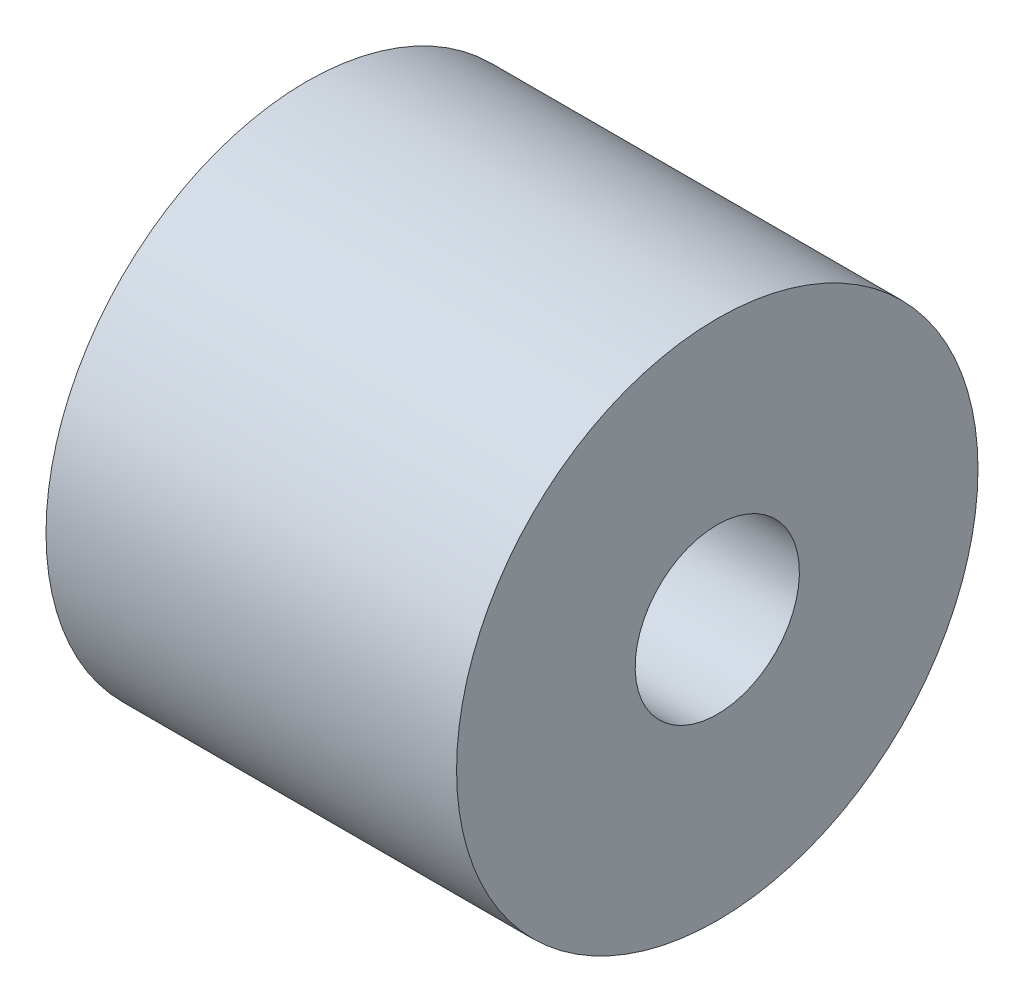
from build123d import *

# Parameters (mm, degrees)
ESQUISSE1_R        = 6.35
ESQUISSE1_R_2      = 2
BOSS_EXTRU_1_DEPTH = 10


with BuildPart() as part:
    # Esquisse1 → Boss.-Extru.1 (new body)
    with BuildSketch(Plane(origin=(-130.403171357, 0, 0), x_dir=(0, 0, -1), z_dir=(1, 0, 0))):
        with Locations(Location((-120.908236412, 39.009623756, 0), (0, 0, 90))):
            Circle(ESQUISSE1_R)
        with Locations(Location((-120.908236412, 39.009623756, 0), (0, 0, 90))):
            Circle(ESQUISSE1_R_2, mode=Mode.SUBTRACT)
    extrude(amount=-BOSS_EXTRU_1_DEPTH)


solid = part.part
